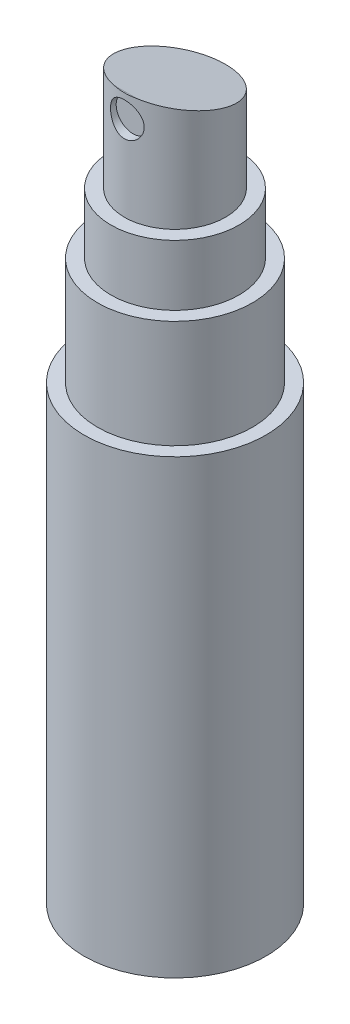
from build123d import *

# Parameters (mm, degrees)
SKETCH1_R           = 13.5
BOSS_EXTRUDE1_DEPTH = 67
SKETCH2_R           = 11.5
BOSS_EXTRUDE2_DEPTH = 16
SKETCH3_R           = 9.5
BOSS_EXTRUDE3_DEPTH = 9
SKETCH4_R           = 7.5
BOSS_EXTRUDE4_DEPTH = 16
CUT_EXTRUDE1_DEPTH  = 111.847868721
SKETCH7_R           = 2.5
CUT_EXTRUDE2_DEPTH  = 1.27


with BuildPart() as part:
    # Sketch1 → Boss-Extrude1 (new body)
    with BuildSketch(Plane(origin=(0, 0, 0), x_dir=(1, 0, 0), z_dir=(0, 1, 0))):
        with Locations(Location((0, 0, 0), (0, 0, 270))):
            Circle(SKETCH1_R)
    extrude(amount=BOSS_EXTRUDE1_DEPTH)

    # Sketch2 → Boss-Extrude2 (add)
    with BuildSketch(Plane(origin=(0, 67, 0), x_dir=(1, 0, 0), z_dir=(0, 1, 0))):
        with Locations(Location((0, 0, 0), (0, 0, 270))):
            Circle(SKETCH2_R)
    extrude(amount=BOSS_EXTRUDE2_DEPTH)

    # Sketch3 → Boss-Extrude3 (add)
    with BuildSketch(Plane(origin=(0, 83, 0), x_dir=(1, 0, 0), z_dir=(0, 1, 0))):
        with Locations(Location((0, 0, 0), (0, 0, 270))):
            Circle(SKETCH3_R)
    extrude(amount=BOSS_EXTRUDE3_DEPTH)

    # Sketch4 → Boss-Extrude4 (add)
    with BuildSketch(Plane(origin=(0, 92, 0), x_dir=(1, 0, 0), z_dir=(0, 1, 0))):
        with Locations(Location((0, 0, 0), (0, 0, 270))):
            Circle(SKETCH4_R)
    extrude(amount=BOSS_EXTRUDE4_DEPTH)

    # Sketch6 → Cut-Extrude1 (cut, through all)
    with BuildSketch(Plane(origin=(7.5, 0, 0), x_dir=(0, 0, -1), z_dir=(1, 0, 0))):
        Polygon((-7.319182821, 108), (8.150119574, 104), (7.994537509, 108), align=None)
    extrude(amount=-CUT_EXTRUDE1_DEPTH, mode=Mode.SUBTRACT)

    # Sketch7 → Cut-Extrude2 (cut)
    with BuildSketch(Plane.XY.offset(7.5)):
        with Locations((0, 104.6)):
            Circle(SKETCH7_R)
    extrude(amount=-CUT_EXTRUDE2_DEPTH, mode=Mode.SUBTRACT)


solid = part.part
